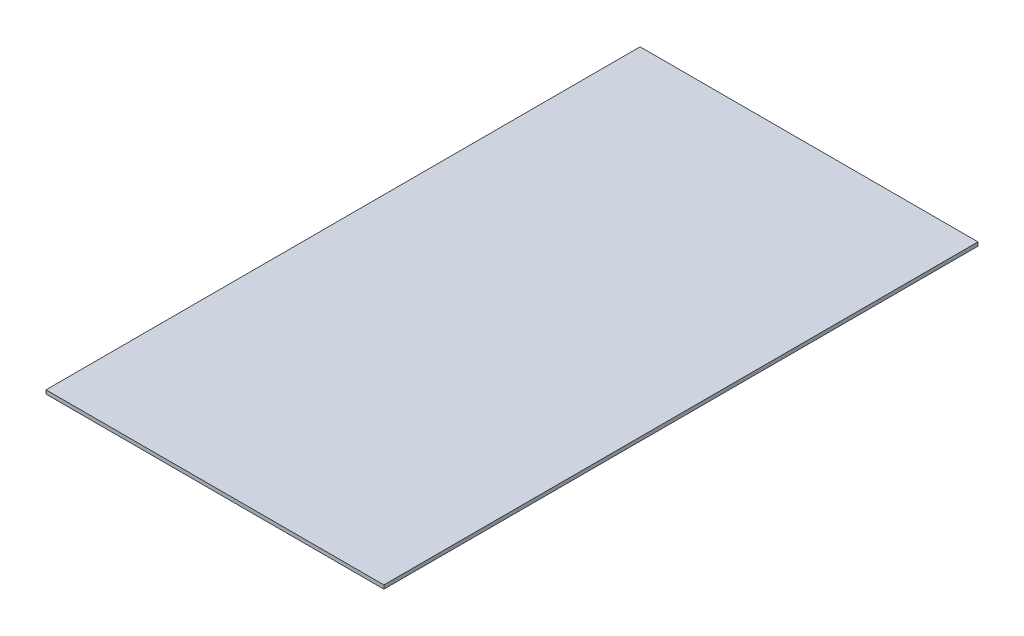
from build123d import *

# Parameters (mm, degrees)
SKETCH1_W           = 455
SKETCH1_H           = 800
BOSS_EXTRUDE1_DEPTH = 5


with BuildPart() as part:
    # Sketch1 → Boss-Extrude1 (new body)
    with BuildSketch(Plane(origin=(0, 0, 0), x_dir=(1, 0, 0), z_dir=(0, 1, 0))):
        Rectangle(SKETCH1_W, SKETCH1_H)
    extrude(amount=BOSS_EXTRUDE1_DEPTH)


solid = part.part
